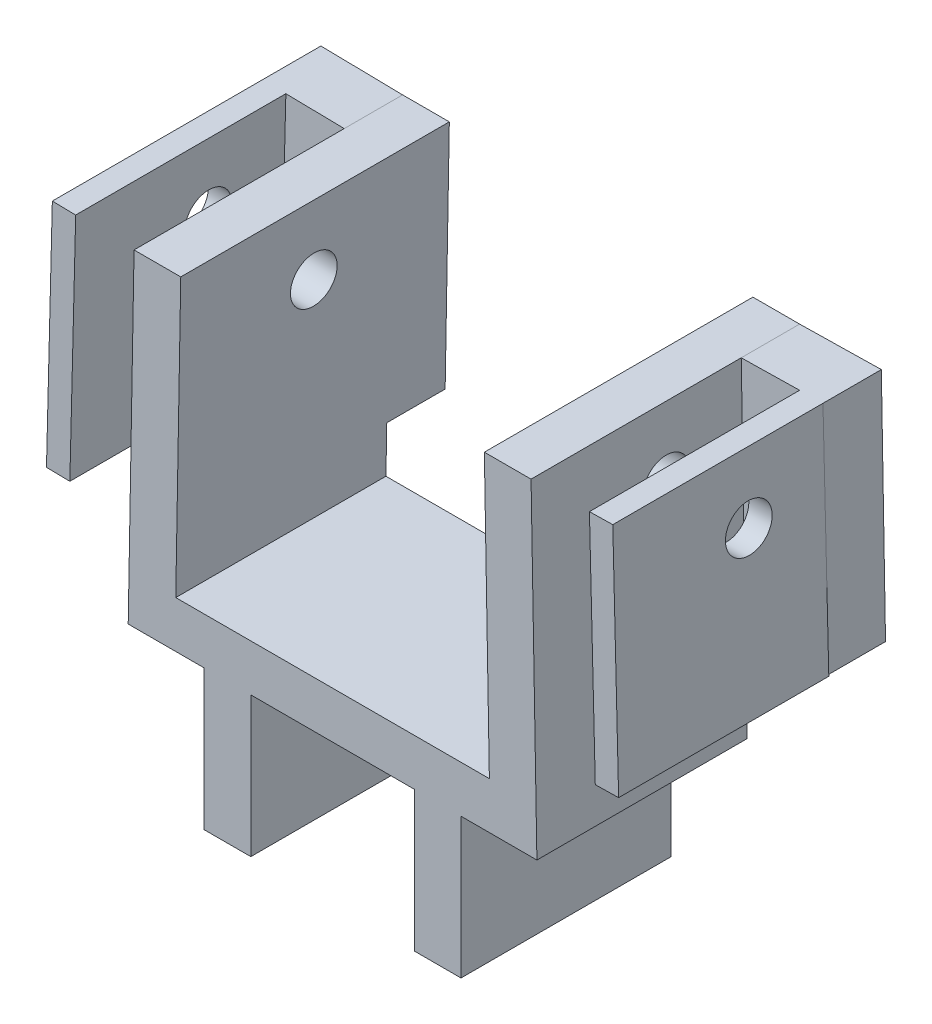
from build123d import *

# Parameters (mm, degrees)
BOSS_EXTRUDE1_DEPTH = 9
BOSS_EXTRUDE2_DEPTH = 2.5
SKETCH5_W           = 2.5
SKETCH5_H           = 10
BOSS_EXTRUDE3_DEPTH = 3.5
BOSS_EXTRUDE4_DEPTH = 9
SKETCH7_R           = 1
CUT_EXTRUDE2_DEPTH  = 9


with BuildPart() as part:
    # Sketch1 → Boss-Extrude1 (new body)
    with BuildSketch(Plane.XY):
        Polygon((-8.689412161, 3.413307669), (-8.5, 14), (-6.5, 14), (-6.714698402, 2), (6.714698402, 2), (6.5, 14), (8.5, 14), (8.695807241, 3.055871556), (8.750481469, 0), (5.5, 0), (5.5, -6), (3.5, -6), (3.5, 0), (-3.5, 0), (-3.5, -6), (-5.5, -6), (-5.5, 0), (-8.750481469, 0), align=None)
    extrude(amount=BOSS_EXTRUDE1_DEPTH)

    # Sketch3 → Boss-Extrude2 (add)
    with BuildSketch(Plane(origin=(0, 0, 0), x_dir=(-1, 0, 0), z_dir=(0, 0, -1))):
        Polygon((-8.5, 14), (-6.5, 14), (-6.678915335, 4), (-8.678915335, 4), align=None)
        Polygon((6.5, 14), (8.5, 14), (8.678915335, 4), (6.678915335, 4), align=None)
    extrude(amount=BOSS_EXTRUDE2_DEPTH)

    # Sketch5 → Boss-Extrude3 (add)
    with BuildSketch(Plane(origin=(8.747681276, 0.156509433, 0), x_dir=(0, 0, -1), z_dir=(0.9998399849293209, 0.01788867061956491, 0))):
        with Locations((1.25, 8.845706089)):
            Rectangle(SKETCH5_W, SKETCH5_H)
    boss_extrude3 = extrude(amount=BOSS_EXTRUDE3_DEPTH)

    # Sketch6 → Boss-Extrude4 (add)
    with BuildSketch(Plane.XY):
        Polygon((10.999439947, 14.044718814), (11.999439947, 14.062610347), (12.249921417, 4.062610347), (11.249921417, 4.044718814), align=None)
    boss_extrude4 = extrude(amount=BOSS_EXTRUDE4_DEPTH)

    # Mirror2: Boss-Extrude3, Boss-Extrude4 across plane
    add(boss_extrude3.mirror(Plane(origin=(0, 0, 0), x_dir=(0, 0, 1), z_dir=(1, 0, 0))))
    add(boss_extrude4.mirror(Plane(origin=(0, 0, 0), x_dir=(0, 0, 1), z_dir=(1, 0, 0))))

    # Sketch7 → Cut-Extrude2 (cut)
    with BuildSketch(Plane(origin=(-6.748321285, 0.120737817, 0), x_dir=(0, 0, -1), z_dir=(0.9998399849293208, -0.017888670619572784, 0))):
        with Locations(Location((-3.25, 10.879562942, 0), (0, 0, 90))):
            Circle(SKETCH7_R)
    cut_extrude2 = extrude(amount=-CUT_EXTRUDE2_DEPTH, mode=Mode.SUBTRACT)

    # Mirror3: Cut-Extrude2 across plane
    add(cut_extrude2.mirror(Plane(origin=(0, 0, 0), x_dir=(0, 0, 1), z_dir=(1, 0, 0))), mode=Mode.SUBTRACT)


solid = part.part
